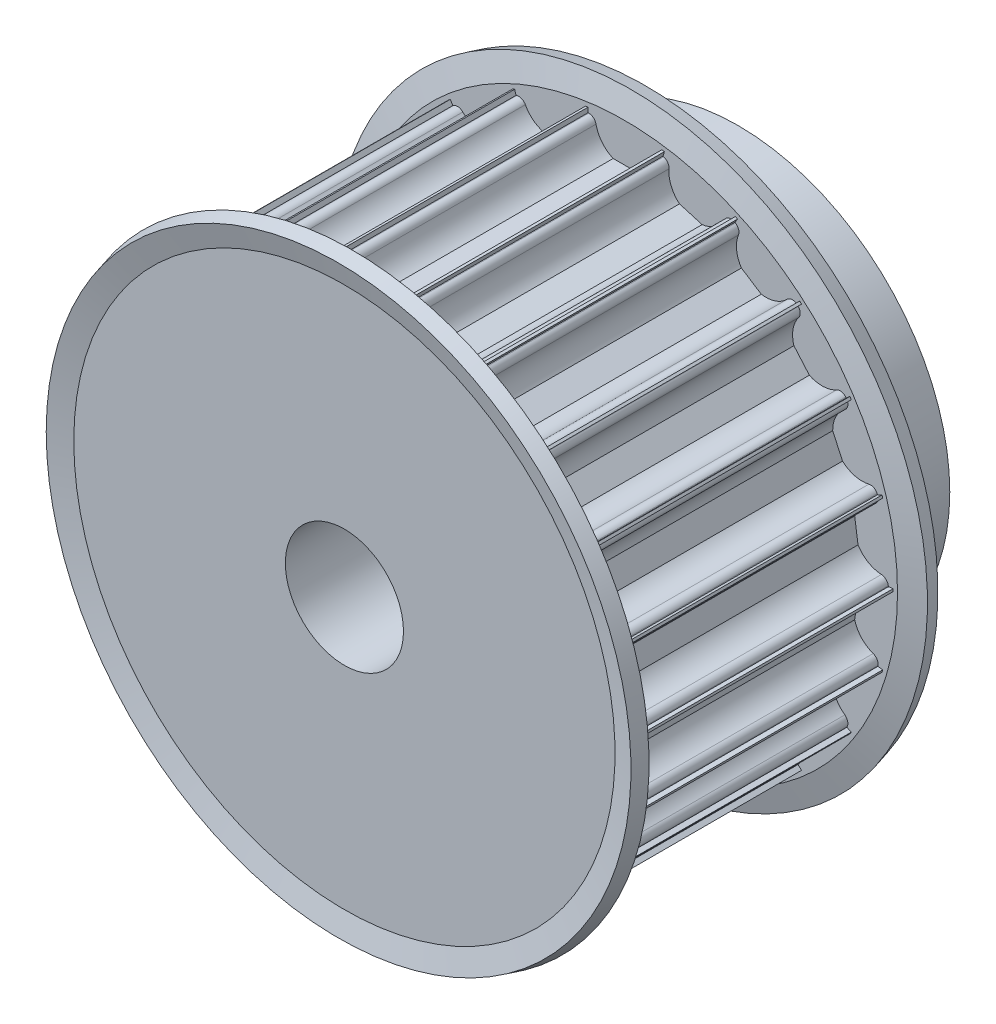
from build123d import *

# Parameters (mm, degrees)
CUT_EXTRUDE1_REACH = 57.544
CIRPATTERN1_COUNT  = 22


with BuildPart() as part:
    # Sketch1 → Revolve1 (revolve)
    with BuildSketch(Plane(origin=(0, 0, 0), x_dir=(0, 0, -1), z_dir=(1, 0, 0)), mode=Mode.PRIVATE) as revolve1_sk:
        Polygon((0, 6), (0, 27.25), (30, 27.25), (30, 21.5), (40, 21.5), (40, 6), align=None)
    revolve(revolve1_sk.sketch.rotate(Axis((0, 0, 0), (0, 0, -1)), 90), axis=Axis((0, 0, 0), (0, 0, -1)))

    # Sketch2 → Cut-Extrude1 (cut, up to next)
    with BuildSketch(Plane.XY, mode=Mode.PRIVATE) as cut_extrude1_sk1:
        with BuildLine():
            Line((-3.674234614, 26.5), (-3.75, 26.5))
            Line((-3.75, 26.5), (-3.75, 28.5))
            Line((-3.75, 28.5), (3.75, 28.5))
            Line((3.75, 28.5), (3.75, 26.5))
            Line((3.75, 26.5), (3.674234614, 26.5))
            ThreePointArc((3.674234614, 26.5), (3.199892965, 26.330947502), (2.939387691, 25.9))
            ThreePointArc((2.939387691, 25.9), (2.331759211, 24.612435701), (1.198957881, 23.75))
            Line((1.198957881, 23.75), (-1.198957881, 23.75))
            ThreePointArc((-1.198957881, 23.75), (-2.331759211, 24.612435701), (-2.939387691, 25.9))
            ThreePointArc((-2.939387691, 25.9), (-3.199892965, 26.330947502), (-3.674234614, 26.5))
        make_face()
    cut_extrude1_tool1 = extrude(cut_extrude1_sk1.sketch, amount=-CUT_EXTRUDE1_REACH, mode=Mode.PRIVATE) & part.part
    cut_extrude1 = cut_extrude1_tool1.solids().sort_by_distance((0, 26.435169, 0))[0]
    add(cut_extrude1, mode=Mode.SUBTRACT)

    # CirPattern1: Cut-Extrude1 ×22 about axis
    cirpattern1_axis = Axis((0, 0, 0), (0, 0, 1))
    for i in range(1, CIRPATTERN1_COUNT):
        add(cut_extrude1.rotate(cirpattern1_axis, i * 360 / CIRPATTERN1_COUNT), mode=Mode.SUBTRACT)

    # Sketch3 → Revolve2 (revolve)
    with BuildSketch(Plane(origin=(0, 0, 0), x_dir=(0, 0, -1), z_dir=(1, 0, 0)), mode=Mode.PRIVATE) as revolve2_sk:
        Polygon((30, 21.5), (30, 27.492521254), (30.591966801, 29.701771432), (29.143078062, 30.09), (28.5, 27.69), (28.5, 21.5), align=None)
        Polygon((1.5, 27.69), (1.5, 21.5), (0, 21.5), (0, 27.492521254), (-0.591966801, 29.701771432), (0.856921938, 30.09), align=None)
    revolve(revolve2_sk.sketch.rotate(Axis((0, 0, 0), (0, 0, 1)), 90), axis=Axis((0, 0, 0), (0, 0, 1)))


solid = part.part
